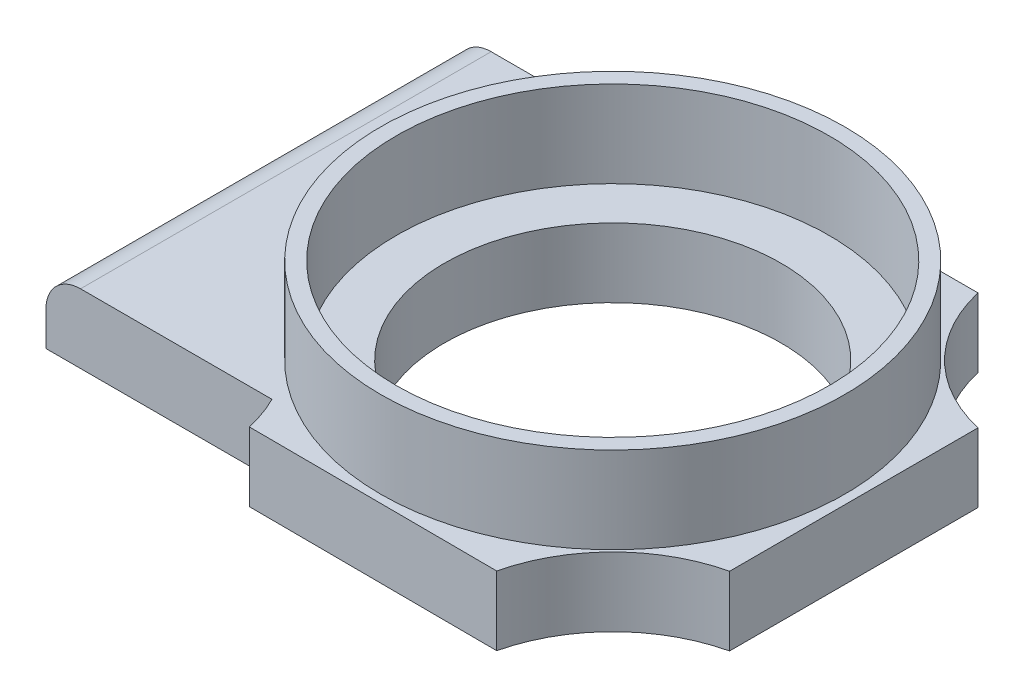
from build123d import *

# Parameters (mm, degrees)
SALIENTE_EXTRUIR4_DEPTH = 20
REDONDEO1_R             = 10
CROQUIS4_3_R            = 4.9
CORTAR_EXTRUIR3_DEPTH   = 10
CROQUIS7_R              = 67.17
CROQUIS7_R_2            = 62.67
SALIENTE_EXTRUIR7_DEPTH = 25
CROQUIS8_R              = 48.75
CORTAR_EXTRUIR4_DEPTH   = 129.538087741


with BuildPart() as part:
    # Croquis2 → Saliente-Extruir4 (new body)
    with BuildSketch(Plane(origin=(0, 0, 0), x_dir=(1, 0, 0), z_dir=(0, 1, 0))):
        with BuildLine():
            Line((-105, 59.8), (-105, -59.1))
            Line((-105, -59.1), (-39.564866762, -59.1))
            ThreePointArc((-39.564866762, -59.1), (-37.4362836, -64.089147092), (-35.920673767, -69.297350411))
            Line((-35.920673767, -69.297350411), (36.010468241, -69.60956711))
            ThreePointArc((36.010468241, -69.60956711), (48.107993991, -47.969702582), (69.8, -35.965922287))
            Line((69.8, -35.965922287), (69.8, 35.965922287))
            ThreePointArc((69.8, 35.965922287), (48.03877349, 48.03877349), (35.965922287, 69.8))
            Line((35.965922287, 69.8), (-35.965922287, 69.8))
            ThreePointArc((-35.965922287, 69.8), (-37.470458506, 64.693854165), (-39.564866762, 59.8))
            Line((-39.564866762, 59.8), (-105, 59.8))
        make_face()
    extrude(amount=SALIENTE_EXTRUIR4_DEPTH)

    # Redondeo1
    redondeo1_edges = [part.edges().sort_by_distance(p)[0] for p in [
        (-105, 20, -0.35),
    ]]
    fillet(redondeo1_edges, radius=REDONDEO1_R)

    # Croquis4<3> → Cortar-Extruir3 (cut)
    with BuildSketch(Plane.XZ):
        with Locations((-95.2, 49.3)):
            Circle(CROQUIS4_3_R)
        with Locations((-66.482433381, 49.3)):
            Circle(CROQUIS4_3_R)
        with Locations((-37.764866762, 49.3)):
            Circle(CROQUIS4_3_R)
        with Locations((-27.120673767, 60.497350411)):
            Circle(CROQUIS4_3_R)
        with Locations((0.044897237, 60.497350411)):
            Circle(CROQUIS4_3_R)
        with Locations((27.210468241, 60.497350411)):
            Circle(CROQUIS4_3_R)
        with Locations((61, 27.165922287)):
            Circle(CROQUIS4_3_R)
        with Locations((39.878985668, 39.547302783)):
            Circle(CROQUIS4_3_R)
        with Locations((61, 0)):
            Circle(CROQUIS4_3_R)
        with Locations((61, -27.165922287)):
            Circle(CROQUIS4_3_R)
        with Locations((27.165922287, -61)):
            Circle(CROQUIS4_3_R)
        with Locations((39.753243225, -39.753243225)):
            Circle(CROQUIS4_3_R)
        with Locations((0, -61)):
            Circle(CROQUIS4_3_R)
        with Locations((-27.165922287, -61)):
            Circle(CROQUIS4_3_R)
        with Locations((-37.764866762, -50)):
            Circle(CROQUIS4_3_R)
        with Locations((-66.482433381, -50)):
            Circle(CROQUIS4_3_R)
        with Locations((-95.2, -50)):
            Circle(CROQUIS4_3_R)
    extrude(amount=-CORTAR_EXTRUIR3_DEPTH, mode=Mode.SUBTRACT)

    # Croquis7 → Saliente-Extruir7 (add)
    with BuildSketch(Plane(origin=(0, 20, 0), x_dir=(1, 0, 0), z_dir=(0, 1, 0))):
        Circle(CROQUIS7_R)
        Circle(CROQUIS7_R_2, mode=Mode.SUBTRACT)
    extrude(amount=SALIENTE_EXTRUIR7_DEPTH)

    # Croquis8 → Cortar-Extruir4 (cut, through all)
    with BuildSketch(Plane(origin=(0, 20, 0), x_dir=(1, 0, 0), z_dir=(0, 1, 0))):
        Circle(CROQUIS8_R)
    extrude(amount=-CORTAR_EXTRUIR4_DEPTH, mode=Mode.SUBTRACT)


solid = part.part
